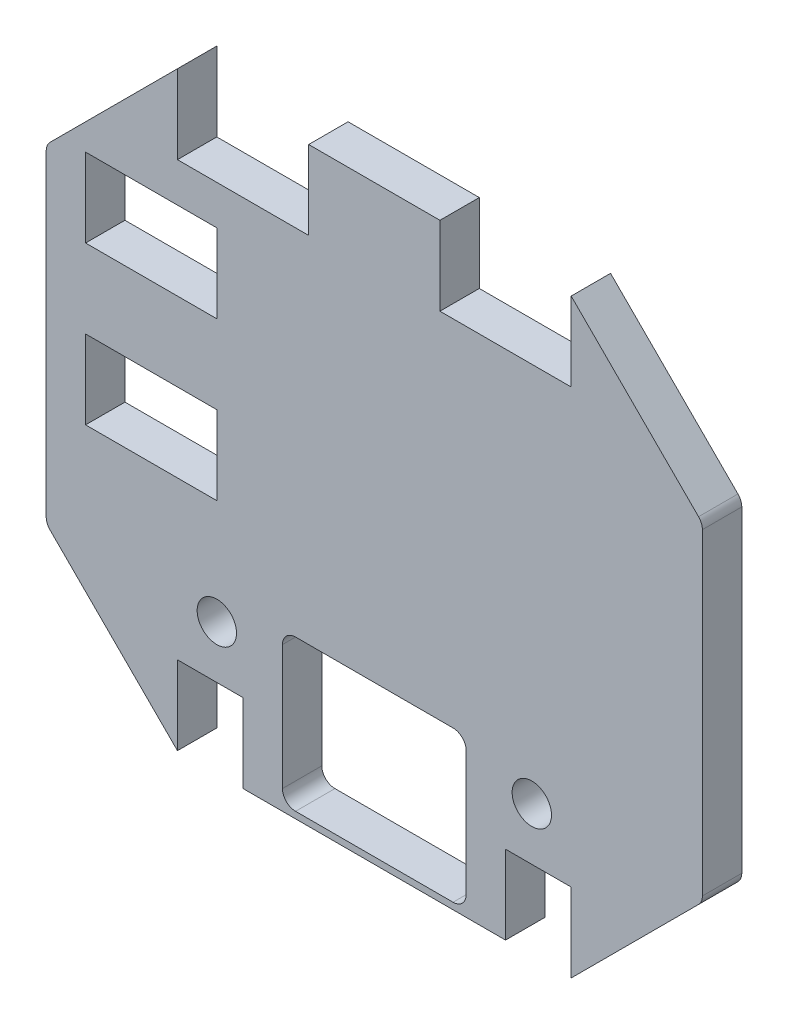
from build123d import *

# Parameters (mm, degrees)
SKETCH1_R           = 1.5
SKETCH1_W           = 14
SKETCH1_H           = 11.5
BOSS_EXTRUDE1_DEPTH = 3
SKETCH2_W           = 10
SKETCH2_H           = 6
SKETCH2_W_2         = 5
CUT_EXTRUDE1_DEPTH  = 62.10646447
SKETCH3_W           = 10
SKETCH3_H           = 6
CUT_EXTRUDE2_DEPTH  = 62.10646447
FILLET1_R           = 1


with BuildPart() as part:
    # Sketch1 → Boss-Extrude1 (new body)
    with BuildSketch(Plane.XY):
        Polygon((0, 0), (0, 25), (10, 35), (40, 35), (50, 25), (50, 0), (40, -10), (10, -10), align=None)
        with Locations((13, 0)):
            Circle(SKETCH1_R, mode=Mode.SUBTRACT)
        with Locations((37, 0)):
            Circle(SKETCH1_R, mode=Mode.SUBTRACT)
        with Locations((25, -3.75)):
            Rectangle(SKETCH1_W, SKETCH1_H, mode=Mode.SUBTRACT)
    extrude(amount=BOSS_EXTRUDE1_DEPTH)

    # Sketch2 → Cut-Extrude1 (cut, through all)
    with BuildSketch(Plane.XY.offset(3)):
        with Locations((15, 32)):
            Rectangle(SKETCH2_W, SKETCH2_H)
        with Locations((35, 32)):
            Rectangle(SKETCH2_W, SKETCH2_H)
        with Locations((12.5, -7)):
            Rectangle(SKETCH2_W_2, SKETCH2_H)
        with Locations((37.5, -7)):
            Rectangle(SKETCH2_W_2, SKETCH2_H)
    extrude(amount=-CUT_EXTRUDE1_DEPTH, mode=Mode.SUBTRACT)

    # Sketch3 → Cut-Extrude2 (cut, through all)
    with BuildSketch(Plane.XY.offset(3)):
        with Locations((8, 11)):
            Rectangle(SKETCH3_W, SKETCH3_H)
        with Locations((8, 23)):
            Rectangle(SKETCH3_W, SKETCH3_H)
    extrude(amount=-CUT_EXTRUDE2_DEPTH, mode=Mode.SUBTRACT)

    # Fillet1
    fillet1_edges = [part.edges().sort_by_distance(p)[0] for p in [
        (0, 0, 1.5),
        (0, 25, 1.5),
        (50, 25, 1.5),
        (50, 0, 1.5),
        (18, 2, 1.5),
        (18, -9.5, 1.5),
        (32, -9.5, 1.5),
        (32, 2, 1.5),
    ]]
    fillet(fillet1_edges, radius=FILLET1_R)


solid = part.part
